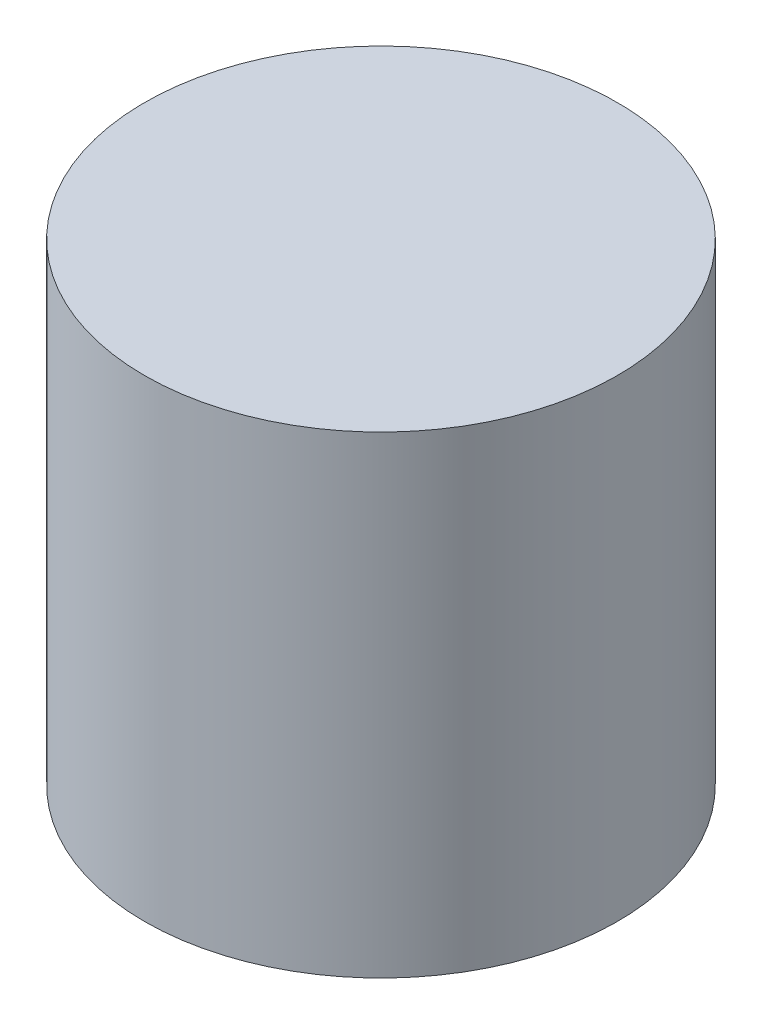
from build123d import *

# Parameters (mm, degrees)
SKETCH1_R           = 50
BOSS_EXTRUDE1_DEPTH = 100


with BuildPart() as part:
    # Sketch1 → Boss-Extrude1 (new body)
    with BuildSketch(Plane(origin=(0, 0, 0), x_dir=(1, 0, 0), z_dir=(0, 1, 0))):
        with Locations(Location((0, 0, 0), (0, 0, 270))):
            Circle(SKETCH1_R)
    extrude(amount=BOSS_EXTRUDE1_DEPTH)


solid = part.part
